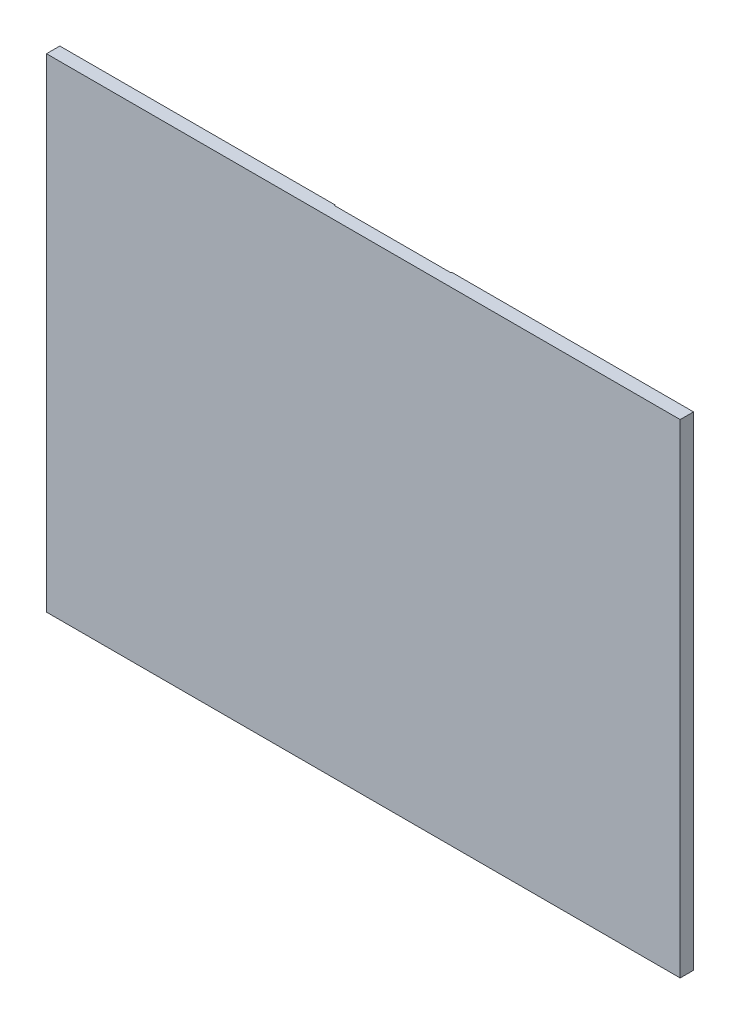
from build123d import *

# Parameters (mm, degrees)
ESQUISSE1_W             = 76
ESQUISSE1_H             = 58
EXTRUSION1_DEPTH        = 1.6
ESQUISSE2_W             = 14
ESQUISSE2_H             = 63.660749159
ENL_V_MAT_EXTRU_1_DEPTH = 0.1


with BuildPart() as part:
    # Esquisse1 → Extrusion1 (new body)
    with BuildSketch(Plane.XY):
        with Locations((19.5, 0)):
            Rectangle(ESQUISSE1_W, ESQUISSE1_H)
    extrude(amount=EXTRUSION1_DEPTH)

    # Esquisse2 → Enlèv. mat.-Extru.1 (cut)
    with BuildSketch(Plane(origin=(0, 0, 0), x_dir=(-1, 0, 0), z_dir=(0, 0, -1))):
        with Locations((-21.5, -0.143811934)):
            Rectangle(ESQUISSE2_W, ESQUISSE2_H)
    extrude(amount=-ENL_V_MAT_EXTRU_1_DEPTH, mode=Mode.SUBTRACT)


solid = part.part
